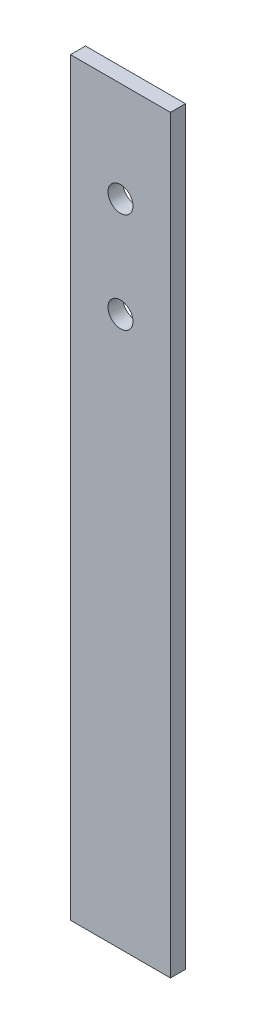
from build123d import *

# Parameters (mm, degrees)
SKETCH1_W           = 20
SKETCH1_H           = 150
SKETCH1_R           = 2.5
BOSS_EXTRUDE1_DEPTH = 3


with BuildPart() as part:
    # Sketch1 → Boss-Extrude1 (new body)
    with BuildSketch(Plane.XY):
        with Locations((82.469314484, 39.011656261)):
            Rectangle(SKETCH1_W, SKETCH1_H)
        with Locations((82.469314484, 74.011656261)):
            Circle(SKETCH1_R, mode=Mode.SUBTRACT)
        with Locations((82.469314484, 94.011656261)):
            Circle(SKETCH1_R, mode=Mode.SUBTRACT)
    extrude(amount=BOSS_EXTRUDE1_DEPTH)


solid = part.part
